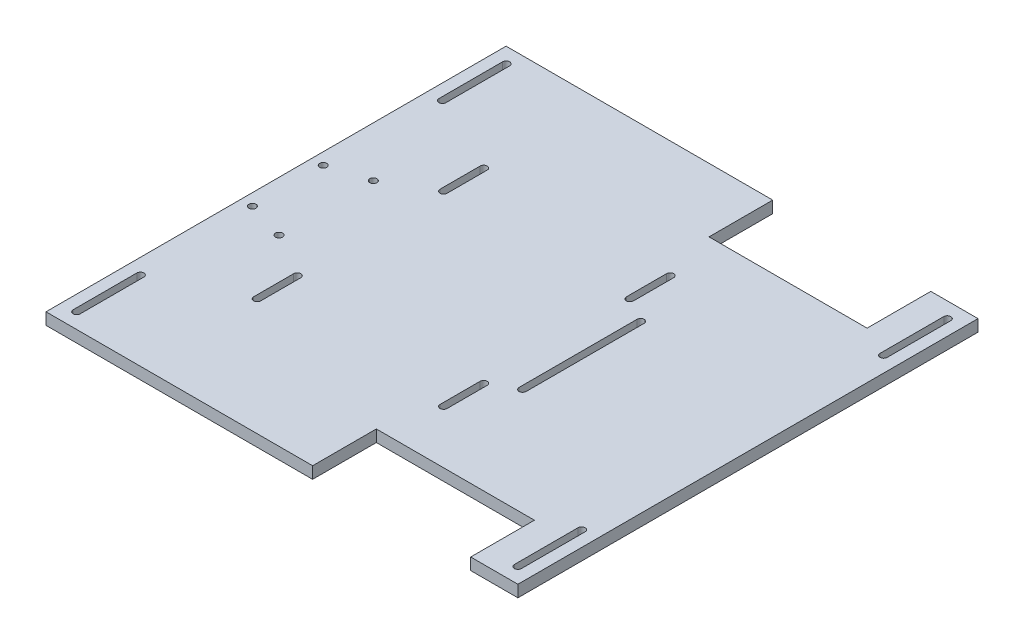
from build123d import *

# Parameters (mm, degrees)
SKETCH2_W           = 200
SKETCH2_H           = 195
BOSS_EXTRUDE1_DEPTH = 5
CUT_EXTRUDE1_DEPTH  = 140.754248594
SKETCH4_W           = 67
SKETCH4_H           = 27
CUT_EXTRUDE2_DEPTH  = 140.754248594
CUT_EXTRUDE4_DEPTH  = 140.754248594
CUT_EXTRUDE5_DEPTH  = 140.754248594
SKETCH8_R           = 1.5
CUT_EXTRUDE6_DEPTH  = 140.754248594
SKETCH9_R           = 1.5
CUT_EXTRUDE7_DEPTH  = 140.754248594


with BuildPart() as part:
    # Sketch2 → Boss-Extrude1 (new body)
    with BuildSketch(Plane(origin=(0, 0, 0), x_dir=(1, 0, 0), z_dir=(0, 1, 0))):
        Rectangle(SKETCH2_W, SKETCH2_H)
    extrude(amount=BOSS_EXTRUDE1_DEPTH)

    # Sketch3 → Cut-Extrude1 (cut, through all)
    with BuildSketch(Plane(origin=(0, 5, 0), x_dir=(1, 0, 0), z_dir=(0, 1, 0))):
        with BuildLine():
            Line((-95, -91), (-95, -64))
            ThreePointArc((-95, -64), (-93.5, -62.5), (-92, -64))
            Line((-92, -64), (-92, -91))
            ThreePointArc((-92, -91), (-93.5, -92.5), (-95, -91))
        make_face()
        with BuildLine():
            Line((-95, 91), (-95, 64))
            ThreePointArc((-95, 64), (-93.5, 62.5), (-92, 64))
            Line((-92, 64), (-92, 91))
            ThreePointArc((-92, 91), (-93.5, 92.5), (-95, 91))
        make_face()
        with BuildLine():
            Line((95, 91), (95, 64))
            ThreePointArc((95, 64), (93.5, 62.5), (92, 64))
            Line((92, 64), (92, 91))
            ThreePointArc((92, 91), (93.5, 92.5), (95, 91))
        make_face()
        with BuildLine():
            Line((95, -91), (95, -64))
            ThreePointArc((95, -64), (93.5, -62.5), (92, -64))
            Line((92, -64), (92, -91))
            ThreePointArc((92, -91), (93.5, -92.5), (95, -91))
        make_face()
    extrude(amount=-CUT_EXTRUDE1_DEPTH, mode=Mode.SUBTRACT)

    # Sketch4 → Cut-Extrude2 (cut, through all)
    with BuildSketch(Plane.XZ):
        with Locations((46.5, -84)):
            Rectangle(SKETCH4_W, SKETCH4_H)
        with Locations((46.5, 84)):
            Rectangle(SKETCH4_W, SKETCH4_H)
    extrude(amount=-CUT_EXTRUDE2_DEPTH, mode=Mode.SUBTRACT)

    # Sketch5 → Cut-Extrude4 (cut, through all)
    with BuildSketch(Plane.XZ):
        with BuildLine():
            Line((-61.5, -48), (-61.5, -31))
            ThreePointArc((-61.5, -31), (-60, -29.5), (-58.5, -31))
            Line((-58.5, -31), (-58.5, -48))
            ThreePointArc((-58.5, -48), (-60, -49.5), (-61.5, -48))
        make_face()
        with BuildLine():
            Line((-61.5, 48), (-61.5, 31))
            ThreePointArc((-61.5, 31), (-60, 29.5), (-58.5, 31))
            Line((-58.5, 31), (-58.5, 48))
            ThreePointArc((-58.5, 48), (-60, 49.5), (-61.5, 48))
        make_face()
        with BuildLine():
            Line((20.5, 48), (20.5, 31))
            ThreePointArc((20.5, 31), (19, 29.5), (17.5, 31))
            Line((17.5, 31), (17.5, 48))
            ThreePointArc((17.5, 48), (19, 49.5), (20.5, 48))
        make_face()
        with BuildLine():
            Line((20.5, -48), (20.5, -31))
            ThreePointArc((20.5, -31), (19, -29.5), (17.5, -31))
            Line((17.5, -31), (17.5, -48))
            ThreePointArc((17.5, -48), (19, -49.5), (20.5, -48))
        make_face()
    extrude(amount=-CUT_EXTRUDE4_DEPTH, mode=Mode.SUBTRACT)

    # Sketch7 → Cut-Extrude5 (cut, through all)
    with BuildSketch(Plane.XZ):
        with BuildLine():
            Line((28, -25), (28, 25))
            ThreePointArc((28, 25), (29.5, 26.5), (31, 25))
            Line((31, 25), (31, -25))
            ThreePointArc((31, -25), (29.5, -26.5), (28, -25))
        make_face()
    extrude(amount=-CUT_EXTRUDE5_DEPTH, mode=Mode.SUBTRACT)

    # Sketch8 → Cut-Extrude6 (cut, through all)
    with BuildSketch(Plane(origin=(0, 5, 0), x_dir=(1, 0, 0), z_dir=(0, 1, 0))):
        with Locations(Location((-78.75, 19.995, 0), (0, 0, 270))):
            Circle(SKETCH8_R)
        with Locations(Location((-78.75, -19.995, 0), (0, 0, 270))):
            Circle(SKETCH8_R)
    extrude(amount=-CUT_EXTRUDE6_DEPTH, mode=Mode.SUBTRACT)

    # Sketch9 → Cut-Extrude7 (cut, through all)
    with BuildSketch(Plane(origin=(0, 5, 0), x_dir=(1, 0, 0), z_dir=(0, 1, 0))):
        with Locations(Location((-95, 15, 0), (0, 0, 270))):
            Circle(SKETCH9_R)
        with Locations(Location((-95, -15, 0), (0, 0, 90))):
            Circle(SKETCH9_R)
    extrude(amount=-CUT_EXTRUDE7_DEPTH, mode=Mode.SUBTRACT)


solid = part.part
